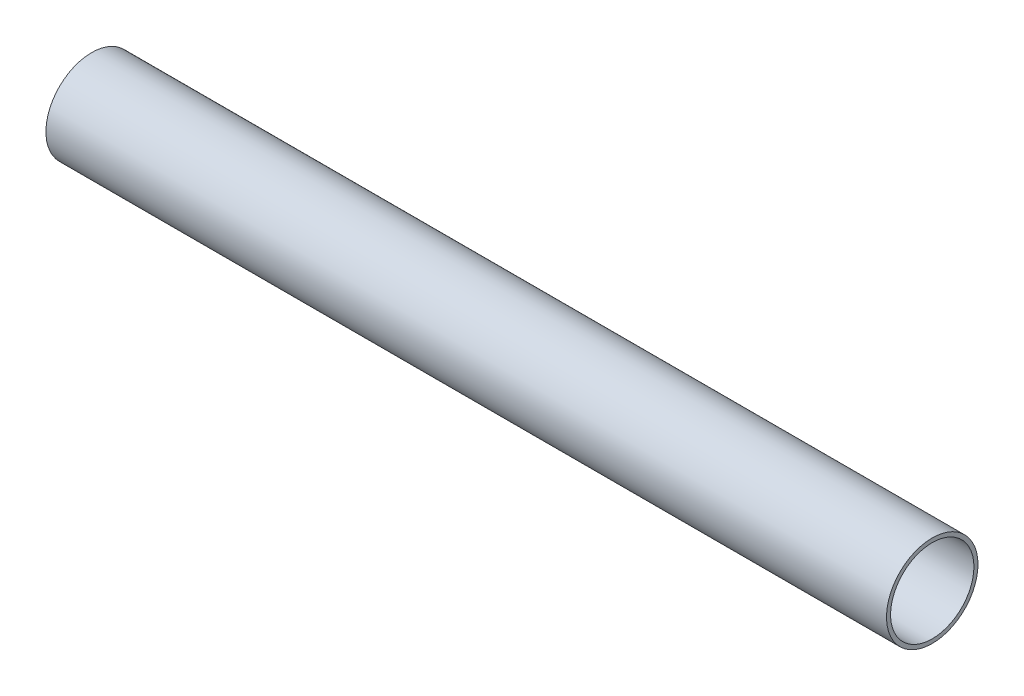
from build123d import *

# Parameters (mm, degrees)
SKIZZE1_R                       = 5.6
SKIZZE1_R_2                     = 5.1
AUFSATZ_LINEAR_AUSTRAGEN1_DEPTH = 51.45


with BuildPart() as part:
    # Skizze1 → Aufsatz-Linear austragen1 (new, symmetric)
    with BuildSketch(Plane(origin=(0, 0, 0), x_dir=(0, 0, -1), z_dir=(1, 0, 0))):
        Circle(SKIZZE1_R)
        Circle(SKIZZE1_R_2, mode=Mode.SUBTRACT)
    extrude(amount=AUFSATZ_LINEAR_AUSTRAGEN1_DEPTH, both=True)


solid = part.part
